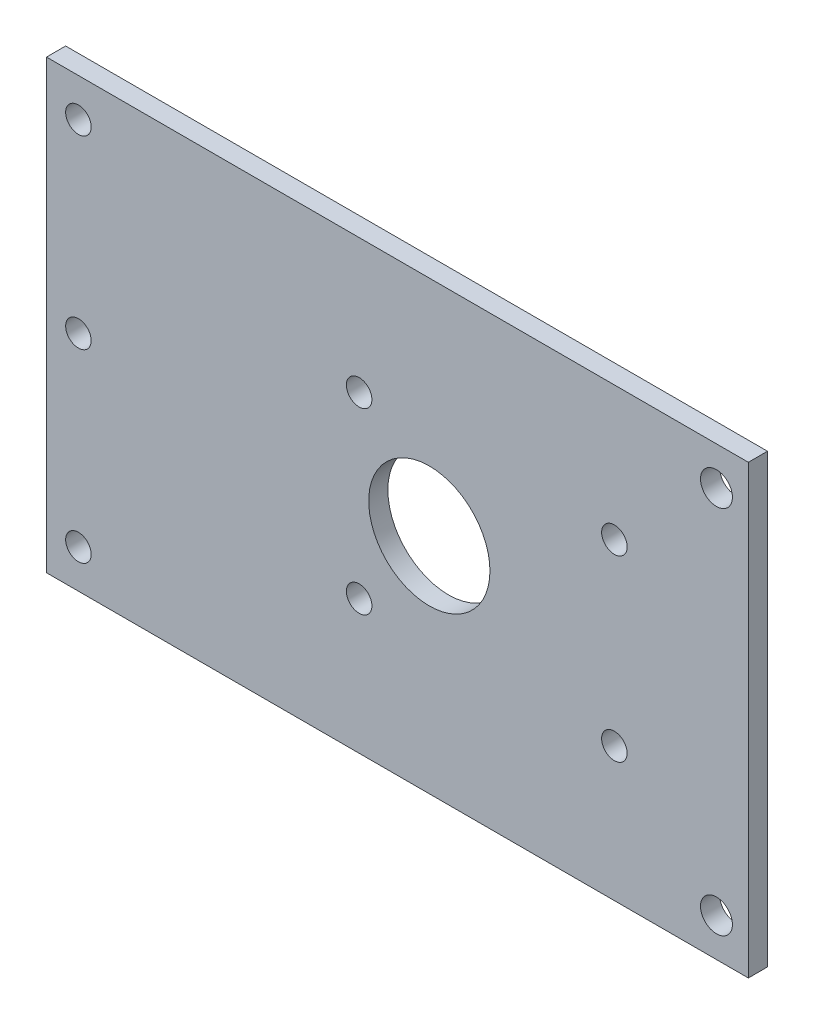
from build123d import *

# Parameters (mm, degrees)
SKETCH1_W           = 110
SKETCH1_H           = 70
BOSS_EXTRUDE1_DEPTH = 3
SKETCH2_R           = 2
SKETCH2_R_2         = 2.5
CUT_EXTRUDE1_DEPTH  = 5
SKETCH3_R           = 9.5
SKETCH3_R_2         = 2
CUT_EXTRUDE3_DEPTH  = 9


with BuildPart() as part:
    # Sketch1 → Boss-Extrude1 (new body)
    with BuildSketch(Plane.XY):
        with Locations((55, 35)):
            Rectangle(SKETCH1_W, SKETCH1_H)
    extrude(amount=BOSS_EXTRUDE1_DEPTH)

    # Sketch2 → Cut-Extrude1 (cut)
    with BuildSketch(Plane.XY.offset(3)):
        with Locations((5, 64)):
            Circle(SKETCH2_R)
        with Locations((5, 6)):
            Circle(SKETCH2_R)
        with Locations((105, 64)):
            Circle(SKETCH2_R_2)
        with Locations((105, 6)):
            Circle(SKETCH2_R_2)
        with Locations((5, 35)):
            Circle(SKETCH2_R)
    extrude(amount=-CUT_EXTRUDE1_DEPTH, mode=Mode.SUBTRACT)

    # Sketch3 → Cut-Extrude3 (cut)
    with BuildSketch(Plane.XY.offset(3)):
        with Locations((60, 35)):
            Circle(SKETCH3_R)
        with Locations((49, 49)):
            Circle(SKETCH3_R_2)
        with Locations((89, 49)):
            Circle(SKETCH3_R_2)
        with Locations(Location((89, 21, 0), (0, 0, 180))):
            Circle(SKETCH3_R_2)
        with Locations(Location((49, 21, 0), (0, 0, 180))):
            Circle(SKETCH3_R_2)
    extrude(amount=-CUT_EXTRUDE3_DEPTH, mode=Mode.SUBTRACT)


solid = part.part
